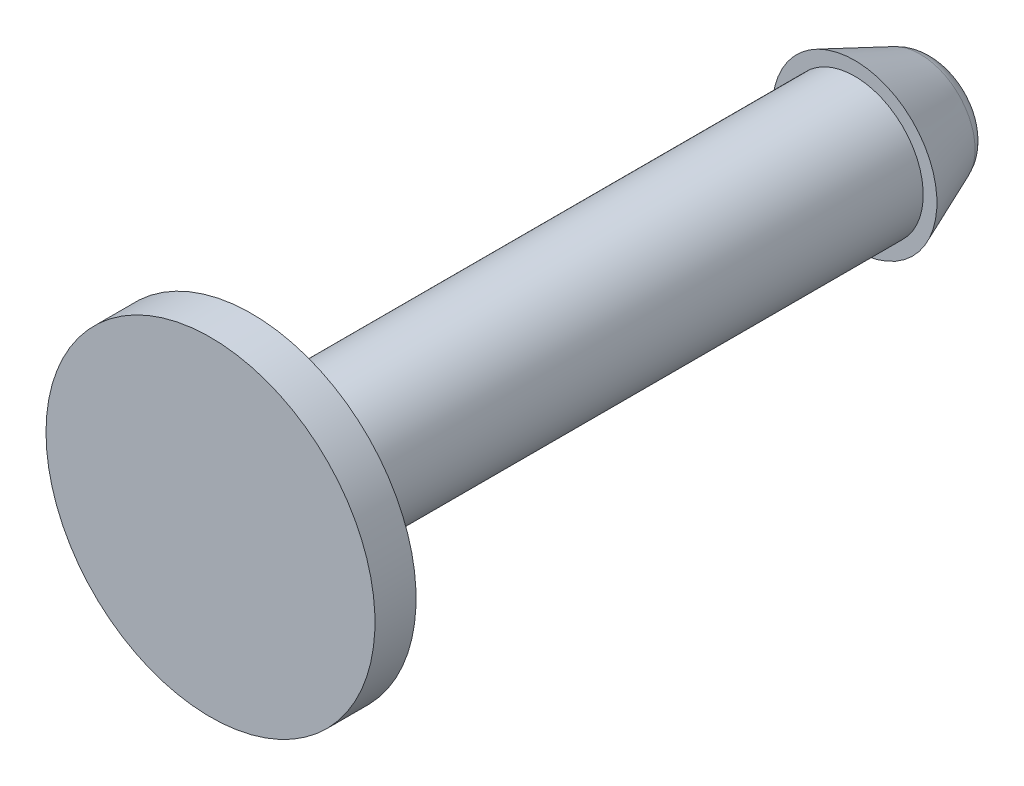
from build123d import *

# Parameters (mm, degrees)
FILLET_1_R = 1


with BuildPart() as part:
    # Эскиз1 → Повернуть1 (revolve)
    with BuildSketch(Plane(origin=(0, 0, 0), x_dir=(1, 0, 0), z_dir=(0, 1, 0)), mode=Mode.PRIVATE) as revolve_1_sk:
        Polygon((1.75, 26.5), (0, 26.5), (0, 0), (6, 0), (6, 1.5), (2.5, 1.5), (2.5, 23.5), (3, 23.5), align=None)
    revolve(revolve_1_sk.sketch.rotate(Axis((0, 0, -26.5), (0, 0, 1)), 180), axis=Axis((0, 0, -26.5), (0, 0, 1)))

    # Скругление1
    fillet_1_edges = [part.edges().sort_by_distance(p)[0] for p in [
        (1.75, 0, -26.5),
    ]]
    fillet(fillet_1_edges, radius=FILLET_1_R)


solid = part.part
